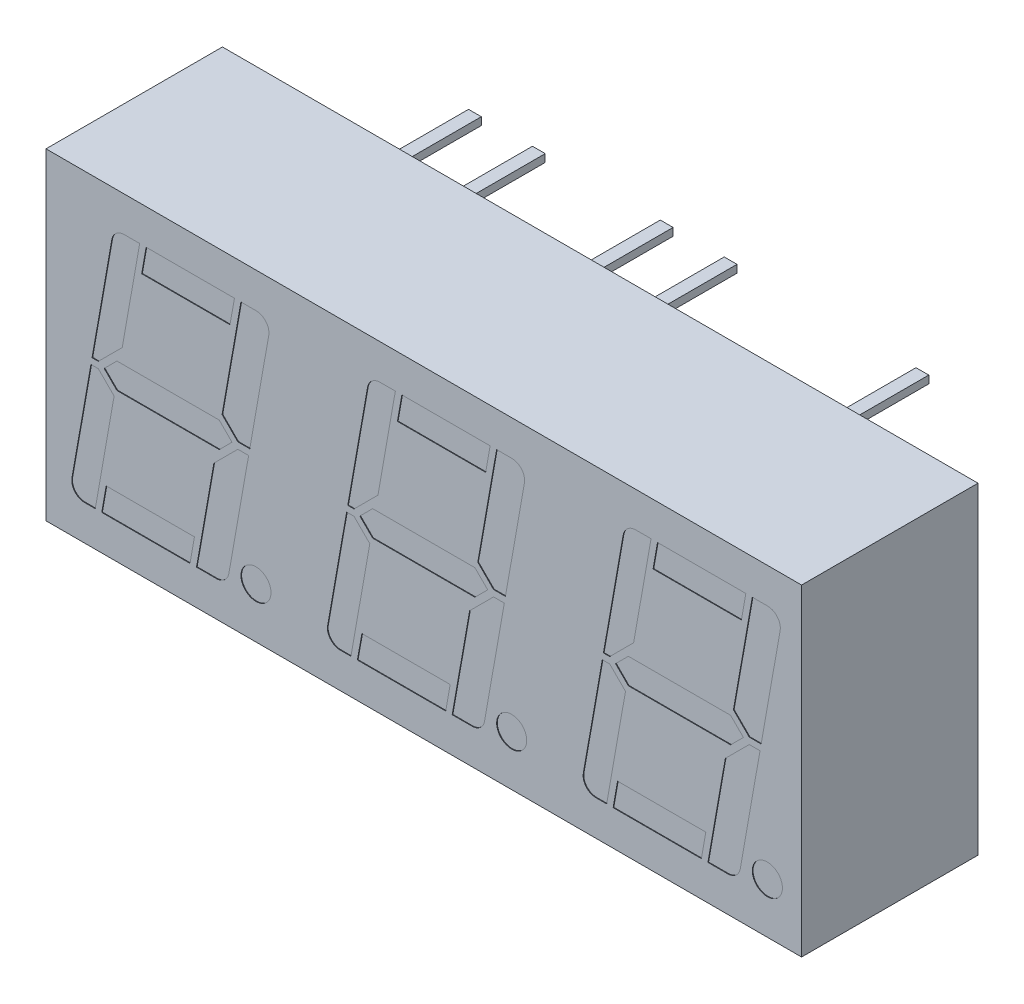
from build123d import *

# Parameters (mm, degrees)
SKETCH1_W            = 30.0228
SKETCH1_H            = 12.8016
BOSS_EXTRUDE1_DEPTH  = 7.0104
SKETCH2_W            = 0.508
SKETCH2_H            = 0.3048
BOSS_EXTRUDE2_DEPTH  = 3.9116
LPATTERN1_COUNT      = 4
LPATTERN1_PITCH      = 2.54
LPATTERN1_COUNT_DIR2 = 2
LPATTERN1_PITCH_DIR2 = 10.16
LPATTERN2_COUNT      = 5
LPATTERN2_PITCH      = 2.54
LPATTERN2_COUNT_DIR2 = 2
LPATTERN2_PITCH_DIR2 = 10.16
SKETCH3_R            = 0.5969
CUT_EXTRUDE1_DEPTH   = 0.0254
LPATTERN3_COUNT      = 2
LPATTERN3_PITCH      = 10.16
LPATTERN4_COUNT      = 2
LPATTERN4_PITCH      = 10.16


with BuildPart() as part:
    # Sketch1 → Boss-Extrude1 (new body)
    with BuildSketch(Plane.XY):
        Rectangle(SKETCH1_W, SKETCH1_H)
    extrude(amount=BOSS_EXTRUDE1_DEPTH)

    # Sketch2 → Boss-Extrude2 (add)
    with BuildSketch(Plane(origin=(0, 0, 0), x_dir=(-1, 0, 0), z_dir=(0, 0, -1))):
        with Locations((-1.27, 5.08)):
            Rectangle(SKETCH2_W, SKETCH2_H)
    boss_extrude2 = extrude(amount=BOSS_EXTRUDE2_DEPTH)

    # LPattern1: Boss-Extrude2 4 × 2, 2 skipped
    with Locations(*[(i * LPATTERN1_PITCH, -j * LPATTERN1_PITCH_DIR2, 0) for i in range(LPATTERN1_COUNT) for j in range(LPATTERN1_COUNT_DIR2) if (i, j) not in ((0, 0), (1, 0), (2, 0))]):
        add(boss_extrude2)

    # LPattern2: Boss-Extrude2 5 × 2, 3 skipped
    with Locations(*[(-i * LPATTERN2_PITCH, -j * LPATTERN2_PITCH_DIR2, 0) for i in range(LPATTERN2_COUNT) for j in range(LPATTERN2_COUNT_DIR2) if (i, j) not in ((0, 0), (0, 1), (2, 0), (4, 1))]):
        add(boss_extrude2)

    # Sketch3 → Cut-Extrude1 (cut)
    with BuildSketch(Plane.XY.offset(7.0104)):
        with Locations((3.4925, -4.4069)):
            Circle(SKETCH3_R)
        Polygon((-2.54, 0), (-2.032, 0.508), (2.032, 0.508), (2.54, 0), (2.032, -0.508), (-2.032, -0.508), align=None)
        with BuildLine():
            Line((-2.772210245, 0.127), (-1.821783863, 1.077426382))
            Line((-1.821783863, 1.077426382), (-1.129458257, 5.0038))
            Line((-1.129458257, 5.0038), (-1.734869082, 5.0038))
            ThreePointArc((-1.734869082, 5.0038), (-2.061405188, 4.884950577), (-2.235151421, 4.584013274))
            Line((-2.235151421, 4.584013274), (-3.021043115, 0.127))
            Line((-3.021043115, 0.127), (-2.772210245, 0.127))
        make_face()
        Polygon((0.882304946, 5.0038), (-0.871539898, 5.0038), (-1.047966446, 4.003235323), (0.705878398, 4.003235323), (2.459723242, 4.003235323), (2.63614979, 5.0038), align=None)
        with BuildLine():
            Line((3.24497838, 0.127), (2.772210245, 0.127))
            Line((2.772210245, 0.127), (2.14478817, 0.754422075))
            Line((2.14478817, 0.754422075), (2.89406815, 5.0038))
            Line((2.89406815, 5.0038), (3.499478975, 5.0038))
            ThreePointArc((3.499478975, 5.0038), (3.888629552, 4.822336106), (3.999761313, 4.407586726))
            Line((3.999761313, 4.407586726), (3.24497838, 0.127))
        make_face()
        with BuildLine():
            Line((1.914017295, -5.0038), (1.129458257, -5.0038))
            Line((1.129458257, -5.0038), (1.821783863, -1.077426382))
            Line((1.821783863, -1.077426382), (2.772210245, -0.127))
            Line((2.772210245, -0.127), (3.200191327, -0.127))
            Line((3.200191327, -0.127), (2.414299633, -4.584013274))
            ThreePointArc((2.414299633, -4.584013274), (2.240553401, -4.884950577), (1.914017295, -5.0038))
        make_face()
        with BuildLine():
            Line((-3.065830168, -0.127), (-2.772210245, -0.127))
            Line((-2.772210245, -0.127), (-2.14478817, -0.754422075))
            Line((-2.14478817, -0.754422075), (-2.89406815, -5.0038))
            Line((-2.89406815, -5.0038), (-3.320330762, -5.0038))
            ThreePointArc((-3.320330762, -5.0038), (-3.709481339, -4.822336106), (-3.820613101, -4.407586726))
            Line((-3.820613101, -4.407586726), (-3.065830168, -0.127))
        make_face()
        Polygon((-0.705878398, -4.003235323), (-2.459723242, -4.003235323), (-2.63614979, -5.0038), (-0.882304946, -5.0038), (0.871539898, -5.0038), (1.047966446, -4.003235323), align=None)
    cut_extrude1 = extrude(amount=-CUT_EXTRUDE1_DEPTH, mode=Mode.SUBTRACT)

    # LPattern3: Cut-Extrude1 ×2
    with Locations(*[(i * LPATTERN3_PITCH, 0, 0) for i in range(1, LPATTERN3_COUNT)]):
        add(cut_extrude1, mode=Mode.SUBTRACT)

    # LPattern4: Cut-Extrude1 ×2
    with Locations(*[(-i * LPATTERN4_PITCH, 0, 0) for i in range(1, LPATTERN4_COUNT)]):
        add(cut_extrude1, mode=Mode.SUBTRACT)


solid = part.part
